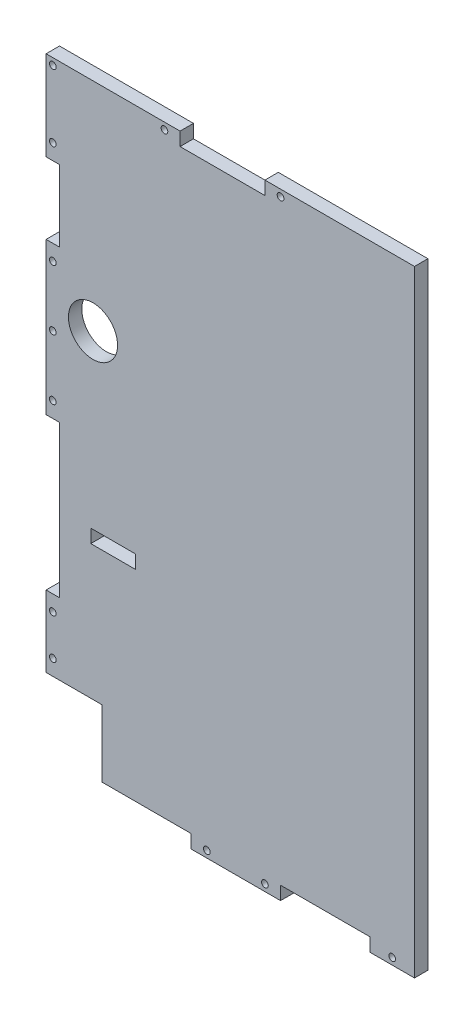
from build123d import *

# Parameters (mm, degrees)
ESQUISSE1_W             = 165
ESQUISSE1_H             = 276
BOSS_EXTRU_1_DEPTH      = 6
ESQUISSE2_W             = 38
ESQUISSE2_H             = 6
ESQUISSE2_W_2           = 6
ESQUISSE2_H_2           = 32
ESQUISSE2_H_3           = 68
ESQUISSE2_W_3           = 40
EXTERIEUR_DEPTH         = 10
ESQUISSE3_R             = 11
ESQUISSE3_W             = 20
ESQUISSE3_H             = 6
ENL_V_MAT_EXTRU_2_DEPTH = 322.616230934
ESQUISSE4_R             = 1.5
ENL_V_MAT_EXTRU_3_DEPTH = 322.616230934
ESQUISSE5_R             = 2.995
ENL_V_MAT_EXTRU_4_DEPTH = 3


with BuildPart() as part:
    # Esquisse1 → Boss.-Extru.1 (new body)
    with BuildSketch(Plane.XY):
        with Locations((-82.5, 138)):
            Rectangle(ESQUISSE1_W, ESQUISSE1_H)
    extrude(amount=BOSS_EXTRU_1_DEPTH)

    # Esquisse2 → exterieur (cut)
    with BuildSketch(Plane.XY.offset(6)):
        with Locations((-86, 273)):
            Rectangle(ESQUISSE2_W, ESQUISSE2_H)
        with Locations((-162, 220)):
            Rectangle(ESQUISSE2_W_2, ESQUISSE2_H_2)
        with Locations((-162, 102)):
            Rectangle(ESQUISSE2_W_2, ESQUISSE2_H_3)
        Polygon((-140, 36), (-140, 6), (-100, 6), (-100, 0), (-165, 0), (-165, 36), align=None)
        with Locations((-40, 3)):
            Rectangle(ESQUISSE2_W_3, ESQUISSE2_H)
    extrude(amount=-EXTERIEUR_DEPTH, mode=Mode.SUBTRACT)

    # Esquisse3 → Enlèv. mat.-Extru.2 (cut, through all)
    with BuildSketch(Plane.XY.offset(6)):
        with Locations((-144, 178.92)):
            Circle(ESQUISSE3_R)
        with Locations((-135, 99)):
            Rectangle(ESQUISSE3_W, ESQUISSE3_H)
    extrude(amount=-ENL_V_MAT_EXTRU_2_DEPTH, mode=Mode.SUBTRACT)

    # Esquisse4 → Enlèv. mat.-Extru.3 (cut, through all)
    with BuildSketch(Plane.XY.offset(6)):
        with Locations((-60, 273)):
            Circle(ESQUISSE4_R)
        with Locations((-112, 273)):
            Circle(ESQUISSE4_R)
        with Locations((-162, 197)):
            Circle(ESQUISSE4_R)
        with Locations((-162, 170)):
            Circle(ESQUISSE4_R)
        with Locations((-162, 143)):
            Circle(ESQUISSE4_R)
        with Locations((-162, 61)):
            Circle(ESQUISSE4_R)
        with Locations((-162, 43)):
            Circle(ESQUISSE4_R)
        with Locations((-93, 3)):
            Circle(ESQUISSE4_R)
        with Locations((-67, 3)):
            Circle(ESQUISSE4_R)
        with Locations((-10, 3)):
            Circle(ESQUISSE4_R)
        with Locations((-162, 273)):
            Circle(ESQUISSE4_R)
        with Locations((-162, 243)):
            Circle(ESQUISSE4_R)
    extrude(amount=-ENL_V_MAT_EXTRU_3_DEPTH, mode=Mode.SUBTRACT)

    # Esquisse5 → Enlèv. mat.-Extru.4 (cut)
    with BuildSketch(Plane(origin=(0, 0, 0), x_dir=(-1, 0, 0), z_dir=(0, 0, -1))):
        with Locations((60, 273)):
            Circle(ESQUISSE5_R)
        with Locations((112, 273)):
            Circle(ESQUISSE5_R)
        with Locations((162, 197)):
            Circle(ESQUISSE5_R)
        with Locations((162, 170)):
            Circle(ESQUISSE5_R)
        with Locations((162, 143)):
            Circle(ESQUISSE5_R)
        with Locations((162, 61)):
            Circle(ESQUISSE5_R)
        with Locations((162, 43)):
            Circle(ESQUISSE5_R)
        with Locations((93, 3)):
            Circle(ESQUISSE5_R)
        with Locations((67, 3)):
            Circle(ESQUISSE5_R)
        with Locations((10, 3)):
            Circle(ESQUISSE5_R)
        with Locations((162, 273)):
            Circle(ESQUISSE5_R)
        with Locations((162, 243)):
            Circle(ESQUISSE5_R)
    extrude(amount=-ENL_V_MAT_EXTRU_4_DEPTH, mode=Mode.SUBTRACT)


solid = part.part
